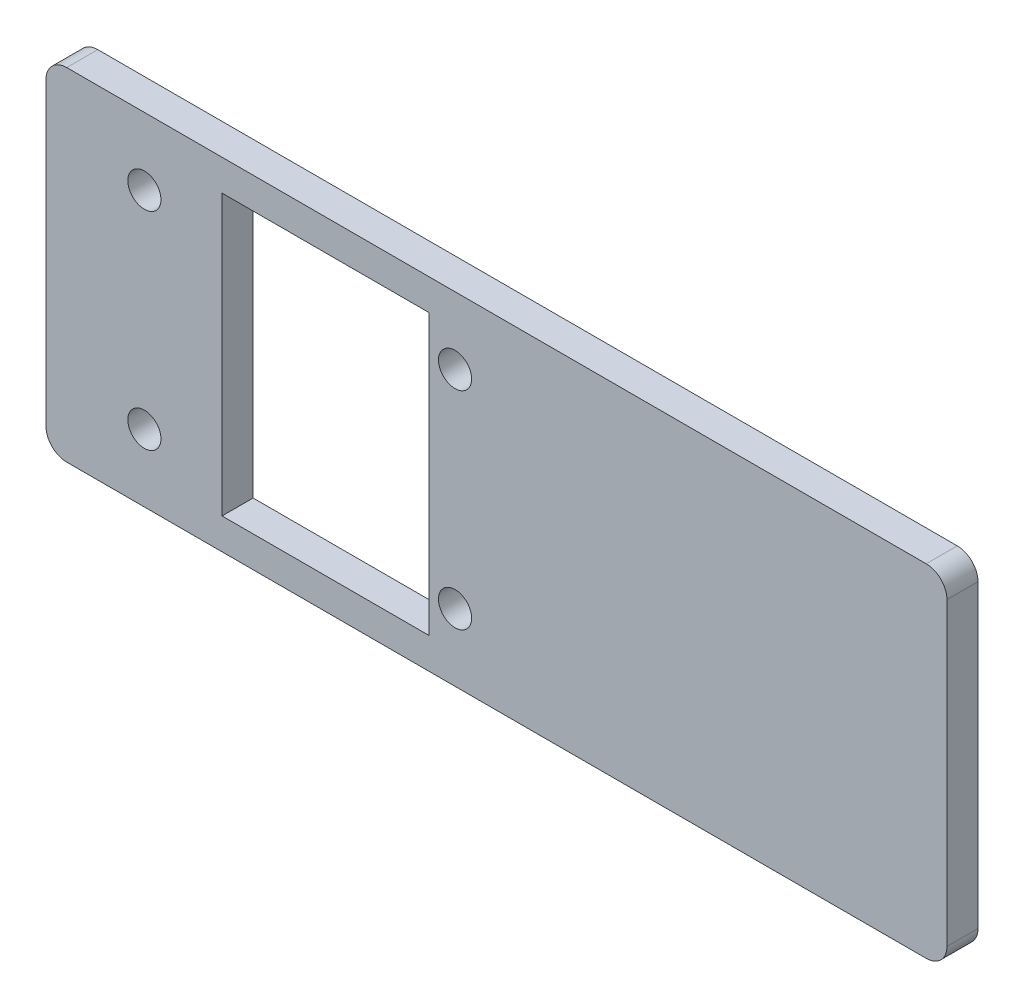
from build123d import *

# Parameters (mm, degrees)
SKETCH1_W           = 87
SKETCH1_H           = 33
SKETCH1_R           = 1.6
BOSS_EXTRUDE2_DEPTH = 3
FILLET1_R           = 2
SKETCH2_W           = 20
SKETCH2_H           = 27
CUT_EXTRUDE1_DEPTH  = 10


with BuildPart() as part:
    # Sketch1 → Boss-Extrude2 (new body)
    with BuildSketch(Plane.XY):
        with Locations((24.332147937, -0.241820768)):
            Rectangle(SKETCH1_W, SKETCH1_H)
        with Locations((-9.667852063, 9.758179232)):
            Circle(SKETCH1_R, mode=Mode.SUBTRACT)
        with Locations((20.332147937, 9.758179232)):
            Circle(SKETCH1_R, mode=Mode.SUBTRACT)
        with Locations((-9.667852063, -10.241820768)):
            Circle(SKETCH1_R, mode=Mode.SUBTRACT)
        with Locations((20.332147937, -10.241820768)):
            Circle(SKETCH1_R, mode=Mode.SUBTRACT)
    extrude(amount=BOSS_EXTRUDE2_DEPTH)

    # Fillet1
    fillet1_edges = [part.edges().sort_by_distance(p)[0] for p in [
        (-19.167852063, 16.258179232, 1.5),
        (67.832147937, 16.258179232, 1.5),
        (67.832147937, -16.741820768, 1.5),
        (-19.167852063, -16.741820768, 1.5),
    ]]
    fillet(fillet1_edges, radius=FILLET1_R)

    # Sketch2 → Cut-Extrude1 (cut)
    with BuildSketch(Plane.XY.offset(3)):
        with Locations((7.832147937, -0.241820768)):
            Rectangle(SKETCH2_W, SKETCH2_H)
    extrude(amount=-CUT_EXTRUDE1_DEPTH, mode=Mode.SUBTRACT)


solid = part.part
